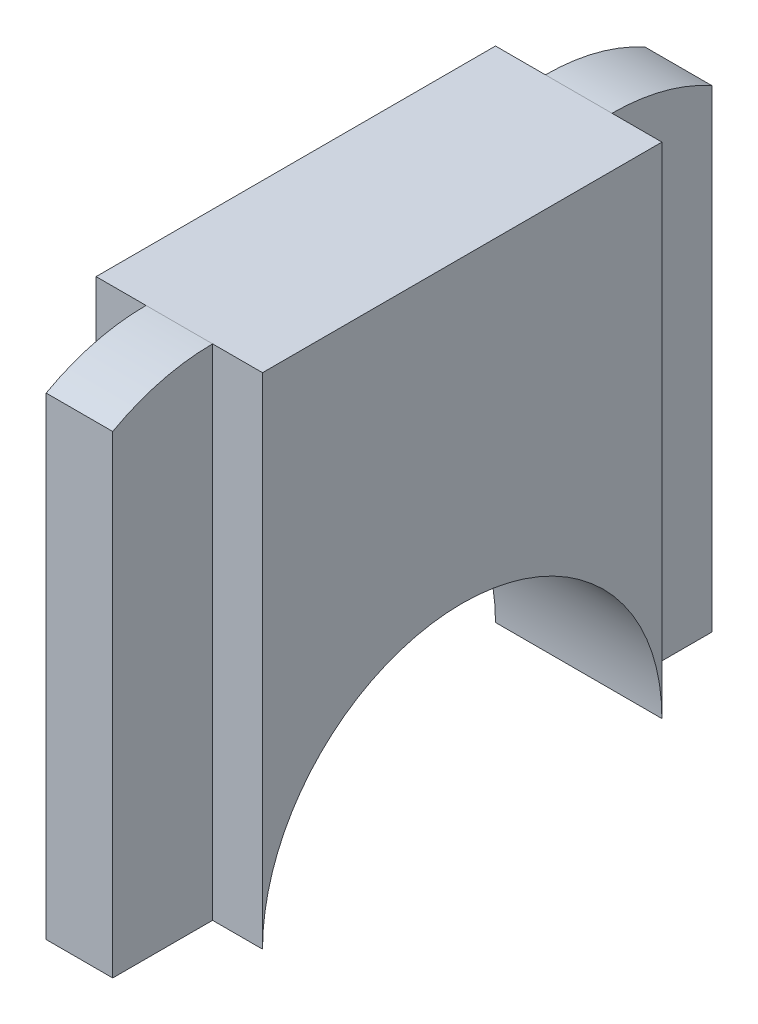
from build123d import *

# Parameters (mm, degrees)
BOSS_EXTRUDE1_DEPTH      = 2.5
BOSS_EXTRUDE1_DEPTH_BACK = 2.5
BOSS_EXTRUDE2_DEPTH      = 1
BOSS_EXTRUDE2_DEPTH_BACK = 1


with BuildPart() as part:
    # Sketch1 → Boss-Extrude1 (new, two sides: drawn at the far end of the back side and taken through both)
    with BuildSketch(Plane(origin=(0, 0, 0), x_dir=(0, 0, -1), z_dir=(1, 0, 0)).offset(-BOSS_EXTRUDE1_DEPTH_BACK)):
        with BuildLine():
            ThreePointArc((-6, 0), (0, 6), (6, 0))
            Line((6, 0), (6, 15))
            Line((6, 15), (-6, 15))
            Line((-6, 15), (-6, 0))
        make_face()
    extrude(amount=BOSS_EXTRUDE1_DEPTH + BOSS_EXTRUDE1_DEPTH_BACK)

    # Sketch1<3> → Boss-Extrude2 (add, two sides: drawn at the far end of the back side and taken through both)
    with BuildSketch(Plane(origin=(0, 0, 0), x_dir=(0, 0, -1), z_dir=(1, 0, 0)).offset(-BOSS_EXTRUDE2_DEPTH_BACK)):
        with BuildLine():
            Line((-6, 0), (-6, 15))
            ThreePointArc((-6, 15), (-7.549870962, 14.801811394), (-9, 14.22))
            Line((-9, 14.22), (-9, 0))
            Line((-9, 0), (-6, 0))
        make_face()
        with BuildLine():
            ThreePointArc((9, 14.22), (7.549870962, 14.801811394), (6, 15))
            Line((6, 15), (6, 0))
            Line((6, 0), (9, 0))
            Line((9, 0), (9, 14.22))
        make_face()
    extrude(amount=BOSS_EXTRUDE2_DEPTH + BOSS_EXTRUDE2_DEPTH_BACK)


solid = part.part
